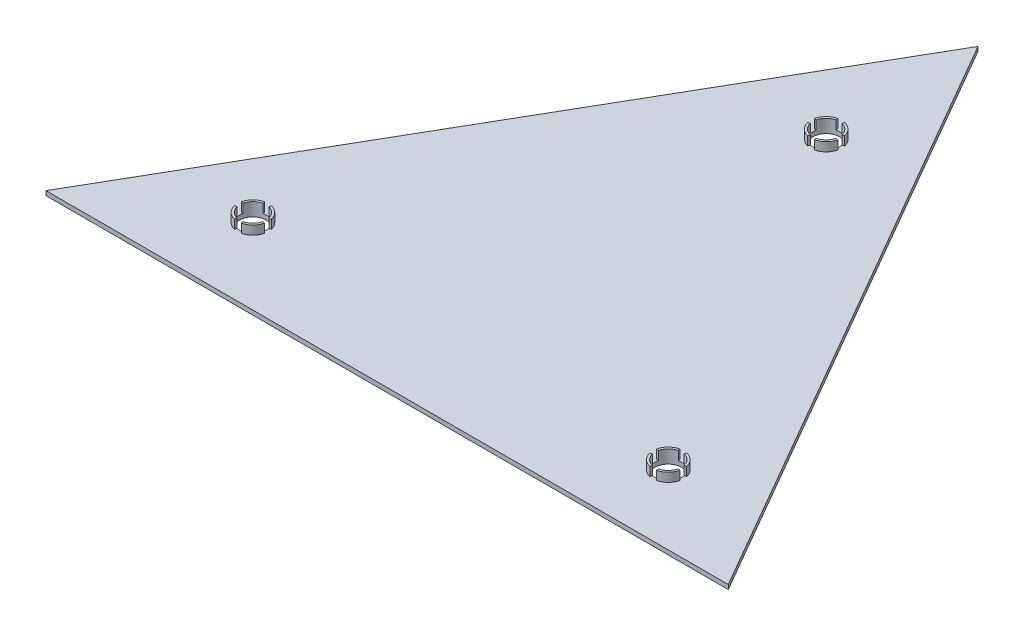
from build123d import *

# Parameters (mm, degrees)
BOSS_EXTRUDE3_DEPTH = 1
BOSS_EXTRUDE4_DEPTH = 3


with BuildPart() as part:
    # Sketch1 → Boss-Extrude3 (new body)
    with BuildSketch(Plane(origin=(0, 0, 0), x_dir=(1, 0, 0), z_dir=(0, 1, 0))):
        Polygon((362.222534427, 19.965180646), (284.852100337, -114.072137645), (439.598290008, -114.060221421), align=None)
        with BuildLine():
            Line((363.912669034, -12.581193275), (364.023092144, -12.093538954))
            ThreePointArc((364.023092144, -12.093538954), (365.725004108, -13.032245467), (366.663710621, -14.734157431))
            Line((366.663710621, -14.734157431), (366.1760563, -14.844580541))
            ThreePointArc((366.1760563, -14.844580541), (366.250130374, -15.507119201), (366.1760563, -16.169657861))
            Line((366.1760563, -16.169657861), (366.663710621, -16.280080971))
            ThreePointArc((366.663710621, -16.280080971), (365.725004108, -17.981992935), (364.023092144, -18.920699448))
            Line((364.023092144, -18.920699448), (363.912669034, -18.433045127))
            ThreePointArc((363.912669034, -18.433045127), (363.250130374, -18.507119201), (362.587591714, -18.433045127))
            Line((362.587591714, -18.433045127), (362.477168604, -18.920699448))
            ThreePointArc((362.477168604, -18.920699448), (360.77525664, -17.981992935), (359.836550127, -16.280080971))
            Line((359.836550127, -16.280080971), (360.324204448, -16.169657861))
            ThreePointArc((360.324204448, -16.169657861), (360.250130374, -15.507119201), (360.324204448, -14.844580541))
            Line((360.324204448, -14.844580541), (359.836550127, -14.734157431))
            ThreePointArc((359.836550127, -14.734157431), (360.77525664, -13.032245467), (362.477168604, -12.093538954))
            Line((362.477168604, -12.093538954), (362.587591714, -12.581193275))
            ThreePointArc((362.587591714, -12.581193275), (363.250130374, -12.507119201), (363.912669034, -12.581193275))
        make_face(mode=Mode.SUBTRACT)
        with BuildLine():
            ThreePointArc((313.830794955, -100.2988546), (312.128882991, -99.360148087), (311.190176478, -97.658236123))
            Line((311.190176478, -97.658236123), (311.677830799, -97.547813013))
            ThreePointArc((311.677830799, -97.547813013), (311.603756725, -96.885274353), (311.677830799, -96.222735693))
            Line((311.677830799, -96.222735693), (311.190176478, -96.112312583))
            ThreePointArc((311.190176478, -96.112312583), (312.128882991, -94.410400619), (313.830794955, -93.471694106))
            Line((313.830794955, -93.471694106), (313.941218065, -93.959348427))
            ThreePointArc((313.941218065, -93.959348427), (314.603756725, -93.885274353), (315.266295385, -93.959348427))
            Line((315.266295385, -93.959348427), (315.376718495, -93.471694106))
            ThreePointArc((315.376718495, -93.471694106), (317.078630459, -94.410400619), (318.017336972, -96.112312583))
            Line((318.017336972, -96.112312583), (317.529682651, -96.222735693))
            ThreePointArc((317.529682651, -96.222735693), (317.603756725, -96.885274353), (317.529682651, -97.547813013))
            Line((317.529682651, -97.547813013), (318.017336972, -97.658236123))
            ThreePointArc((318.017336972, -97.658236123), (317.078630459, -99.360148087), (315.376718495, -100.2988546))
            Line((315.376718495, -100.2988546), (315.266295385, -99.811200279))
            ThreePointArc((315.266295385, -99.811200279), (314.603756725, -99.885274353), (313.941218065, -99.811200279))
            Line((313.941218065, -99.811200279), (313.830794955, -100.2988546))
        make_face(mode=Mode.SUBTRACT)
        with BuildLine():
            ThreePointArc((406.858805843, -97.563455036), (407.797512356, -95.861543072), (409.49942432, -94.922836559))
            Line((409.49942432, -94.922836559), (409.60984743, -95.41049088))
            ThreePointArc((409.60984743, -95.41049088), (410.27238609, -95.336416806), (410.93492475, -95.41049088))
            Line((410.93492475, -95.41049088), (411.04534786, -94.922836559))
            ThreePointArc((411.04534786, -94.922836559), (412.747259824, -95.861543072), (413.685966337, -97.563455036))
            Line((413.685966337, -97.563455036), (413.198312016, -97.673878146))
            ThreePointArc((413.198312016, -97.673878146), (413.27238609, -98.336416806), (413.198312016, -98.998955466))
            Line((413.198312016, -98.998955466), (413.685966337, -99.109378576))
            ThreePointArc((413.685966337, -99.109378576), (412.747259824, -100.81129054), (411.04534786, -101.749997053))
            Line((411.04534786, -101.749997053), (410.93492475, -101.262342732))
            ThreePointArc((410.93492475, -101.262342732), (410.27238609, -101.336416806), (409.60984743, -101.262342732))
            Line((409.60984743, -101.262342732), (409.49942432, -101.749997053))
            ThreePointArc((409.49942432, -101.749997053), (407.797512356, -100.81129054), (406.858805843, -99.109378576))
            Line((406.858805843, -99.109378576), (407.346460164, -98.998955466))
            ThreePointArc((407.346460164, -98.998955466), (407.272389017, -98.332225876), (407.348322685, -97.665705839))
            Line((407.348322685, -97.665705839), (406.858805843, -97.563455036))
        make_face(mode=Mode.SUBTRACT)
    extrude(amount=BOSS_EXTRUDE3_DEPTH)

    # Sketch1<15> → Boss-Extrude4 (add)
    with BuildSketch(Plane(origin=(0, 0, 0), x_dir=(1, 0, 0), z_dir=(0, 1, 0))):
        with BuildLine():
            Line((315.266295385, -99.811200279), (315.376718495, -100.2988546))
            ThreePointArc((315.376718495, -100.2988546), (317.078630459, -99.360148087), (318.017336972, -97.658236123))
            Line((318.017336972, -97.658236123), (317.529682651, -97.547813013))
            ThreePointArc((317.529682651, -97.547813013), (316.725077068, -99.006594697), (315.266295385, -99.811200279))
        make_face()
        with BuildLine():
            ThreePointArc((318.017336972, -96.112312583), (317.078630459, -94.410400619), (315.376718495, -93.471694106))
            Line((315.376718495, -93.471694106), (315.266295385, -93.959348427))
            ThreePointArc((315.266295385, -93.959348427), (316.725077068, -94.76395401), (317.529682651, -96.222735693))
            Line((317.529682651, -96.222735693), (318.017336972, -96.112312583))
        make_face()
        with BuildLine():
            Line((311.677830799, -97.547813013), (311.190176478, -97.658236123))
            ThreePointArc((311.190176478, -97.658236123), (312.128882991, -99.360148087), (313.830794955, -100.2988546))
            Line((313.830794955, -100.2988546), (313.941218065, -99.811200279))
            ThreePointArc((313.941218065, -99.811200279), (312.482436381, -99.006594697), (311.677830799, -97.547813013))
        make_face()
        with BuildLine():
            ThreePointArc((313.830794955, -93.471694106), (312.128882991, -94.410400619), (311.190176478, -96.112312583))
            Line((311.190176478, -96.112312583), (311.677830799, -96.222735693))
            ThreePointArc((311.677830799, -96.222735693), (312.482436381, -94.76395401), (313.941218065, -93.959348427))
            Line((313.941218065, -93.959348427), (313.830794955, -93.471694106))
        make_face()
        with BuildLine():
            Line((407.346460164, -98.998955466), (406.858805843, -99.109378576))
            ThreePointArc((406.858805843, -99.109378576), (407.797512356, -100.81129054), (409.49942432, -101.749997053))
            Line((409.49942432, -101.749997053), (409.60984743, -101.262342732))
            ThreePointArc((409.60984743, -101.262342732), (408.151065747, -100.457737149), (407.346460164, -98.998955466))
        make_face()
        with BuildLine():
            ThreePointArc((411.04534786, -101.749997053), (412.747259824, -100.81129054), (413.685966337, -99.109378576))
            Line((413.685966337, -99.109378576), (413.198312016, -98.998955466))
            ThreePointArc((413.198312016, -98.998955466), (412.393706434, -100.457737149), (410.93492475, -101.262342732))
            Line((410.93492475, -101.262342732), (411.04534786, -101.749997053))
        make_face()
        with BuildLine():
            ThreePointArc((413.685966337, -97.563455036), (412.747259824, -95.861543072), (411.04534786, -94.922836559))
            Line((411.04534786, -94.922836559), (410.93492475, -95.41049088))
            ThreePointArc((410.93492475, -95.41049088), (412.393706434, -96.215096462), (413.198312016, -97.673878146))
            Line((413.198312016, -97.673878146), (413.685966337, -97.563455036))
        make_face()
        with BuildLine():
            Line((409.60984743, -95.41049088), (409.49942432, -94.922836559))
            ThreePointArc((409.49942432, -94.922836559), (407.797512356, -95.861543072), (406.858805843, -97.563455036))
            Line((406.858805843, -97.563455036), (407.348322685, -97.665705839))
            ThreePointArc((407.348322685, -97.665705839), (408.154031252, -96.212135097), (409.60984743, -95.41049088))
        make_face()
        with BuildLine():
            Line((360.324204448, -16.169657861), (359.836550127, -16.280080971))
            ThreePointArc((359.836550127, -16.280080971), (360.77525664, -17.981992935), (362.477168604, -18.920699448))
            Line((362.477168604, -18.920699448), (362.587591714, -18.433045127))
            ThreePointArc((362.587591714, -18.433045127), (361.128810031, -17.628439544), (360.324204448, -16.169657861))
        make_face()
        with BuildLine():
            ThreePointArc((364.023092144, -18.920699448), (365.725004108, -17.981992935), (366.663710621, -16.280080971))
            Line((366.663710621, -16.280080971), (366.1760563, -16.169657861))
            ThreePointArc((366.1760563, -16.169657861), (365.371450718, -17.628439544), (363.912669034, -18.433045127))
            Line((363.912669034, -18.433045127), (364.023092144, -18.920699448))
        make_face()
        with BuildLine():
            Line((362.587591714, -12.581193275), (362.477168604, -12.093538954))
            ThreePointArc((362.477168604, -12.093538954), (360.77525664, -13.032245467), (359.836550127, -14.734157431))
            Line((359.836550127, -14.734157431), (360.324204448, -14.844580541))
            ThreePointArc((360.324204448, -14.844580541), (361.128810031, -13.385798857), (362.587591714, -12.581193275))
        make_face()
        with BuildLine():
            ThreePointArc((366.663710621, -14.734157431), (365.725004108, -13.032245467), (364.023092144, -12.093538954))
            Line((364.023092144, -12.093538954), (363.912669034, -12.581193275))
            ThreePointArc((363.912669034, -12.581193275), (365.371450718, -13.385798857), (366.1760563, -14.844580541))
            Line((366.1760563, -14.844580541), (366.663710621, -14.734157431))
        make_face()
    extrude(amount=BOSS_EXTRUDE4_DEPTH)


solid = part.part
